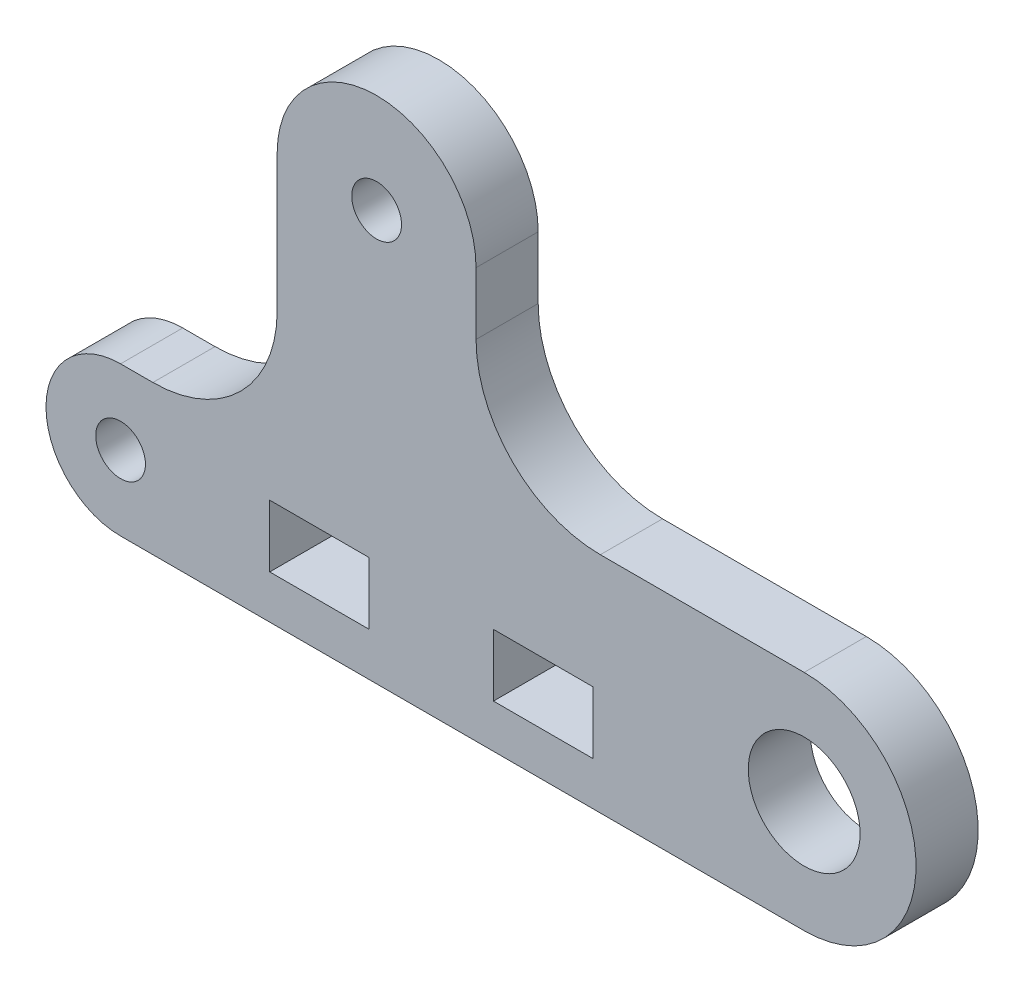
from build123d import *

# Parameters (mm, degrees)
SKETCH1_R           = 4.5
SKETCH1_R_2         = 2
SKETCH1_R_3         = 2.003539683
SKETCH1_W           = 8
SKETCH1_H           = 5
BOSS_EXTRUDE1_DEPTH = 2.5


with BuildPart() as part:
    # Sketch1 → Boss-Extrude1 (new, symmetric)
    with BuildSketch(Plane.XY):
        with BuildLine():
            Line((-27.5, 0), (27.5, 0))
            ThreePointArc((27.5, 0), (36.5, 9), (27.5, 18))
            Line((27.5, 18), (11.1, 18))
            ThreePointArc((11.1, 18), (4.028932188, 20.928932188), (1.1, 28))
            Line((1.1, 28), (1.1, 33))
            ThreePointArc((1.1, 33), (-6.9, 41), (-14.9, 33))
            Line((-14.9, 33), (-14.9, 22))
            ThreePointArc((-14.9, 22), (-17.828932188, 14.928932188), (-24.9, 12))
            Line((-24.9, 12), (-27.5, 12))
            ThreePointArc((-27.5, 12), (-33.5, 6), (-27.5, 0))
        make_face()
        with Locations((27.5, 9)):
            Circle(SKETCH1_R, mode=Mode.SUBTRACT)
        with Locations((-27.5, 6)):
            Circle(SKETCH1_R_2, mode=Mode.SUBTRACT)
        with Locations((-6.9, 33)):
            Circle(SKETCH1_R_3, mode=Mode.SUBTRACT)
        with Locations((-11.5, 6)):
            Rectangle(SKETCH1_W, SKETCH1_H, mode=Mode.SUBTRACT)
        with Locations((6.5, 6)):
            Rectangle(SKETCH1_W, SKETCH1_H, mode=Mode.SUBTRACT)
    extrude(amount=BOSS_EXTRUDE1_DEPTH, both=True)


solid = part.part
